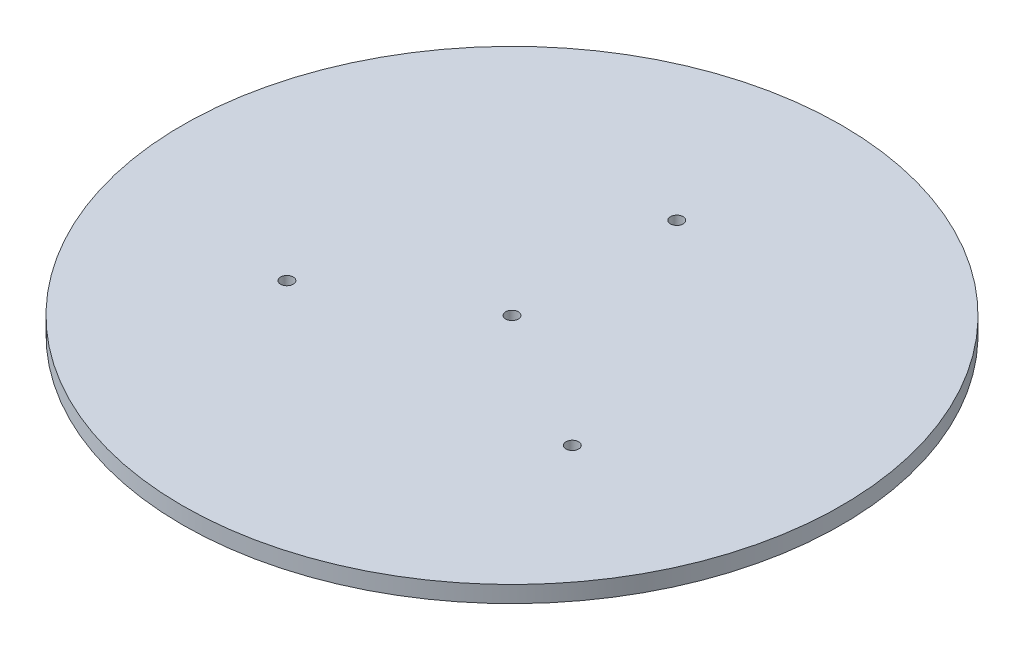
from build123d import *

# Parameters (mm, degrees)
SKETCH1_R           = 126.14275
SKETCH1_R_2         = 2.4257
BOSS_EXTRUDE1_DEPTH = 6.35


with BuildPart() as part:
    # Sketch1 → Boss-Extrude1 (new body)
    with BuildSketch(Plane(origin=(0, 0, 0), x_dir=(1, 0, 0), z_dir=(0, 1, 0))):
        with Locations(Location((0, 0, 0), (0, 0, 270))):
            Circle(SKETCH1_R)
        with Locations(Location((0, 63.071375, 0), (0, 0, 270))):
            Circle(SKETCH1_R_2, mode=Mode.SUBTRACT)
        with Locations(Location((54.621413002, -31.5356875, 0), (0, 0, 270))):
            Circle(SKETCH1_R_2, mode=Mode.SUBTRACT)
        with Locations(Location((-54.621413002, -31.5356875, 0), (0, 0, 270))):
            Circle(SKETCH1_R_2, mode=Mode.SUBTRACT)
        with Locations(Location((0, 0, 0), (0, 0, 270))):
            Circle(SKETCH1_R_2, mode=Mode.SUBTRACT)
    extrude(amount=BOSS_EXTRUDE1_DEPTH)


solid = part.part
